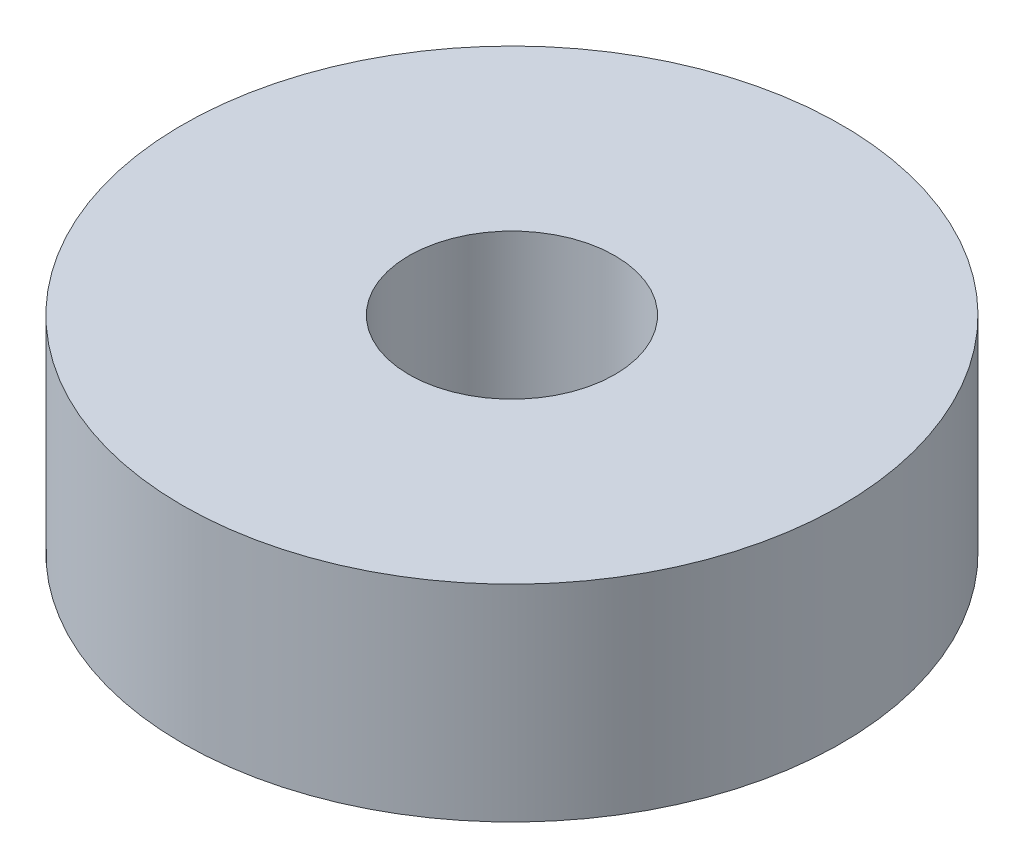
from build123d import *

# Parameters (mm, degrees)
SKETCH_1_R      = 8
SKETCH_1_R_2    = 2.5
EXTRUDE_1_DEPTH = 5


with BuildPart() as part:
    # Эскиз1 → Бобышка-Вытянуть1 (new body)
    with BuildSketch(Plane(origin=(0, 0, 0), x_dir=(1, 0, 0), z_dir=(0, 1, 0))):
        with Locations(Location((0, 0, 0), (0, 0, 270))):
            Circle(SKETCH_1_R)
        with Locations(Location((0, 0, 0), (0, 0, 270))):
            Circle(SKETCH_1_R_2, mode=Mode.SUBTRACT)
    extrude(amount=EXTRUDE_1_DEPTH)


solid = part.part
